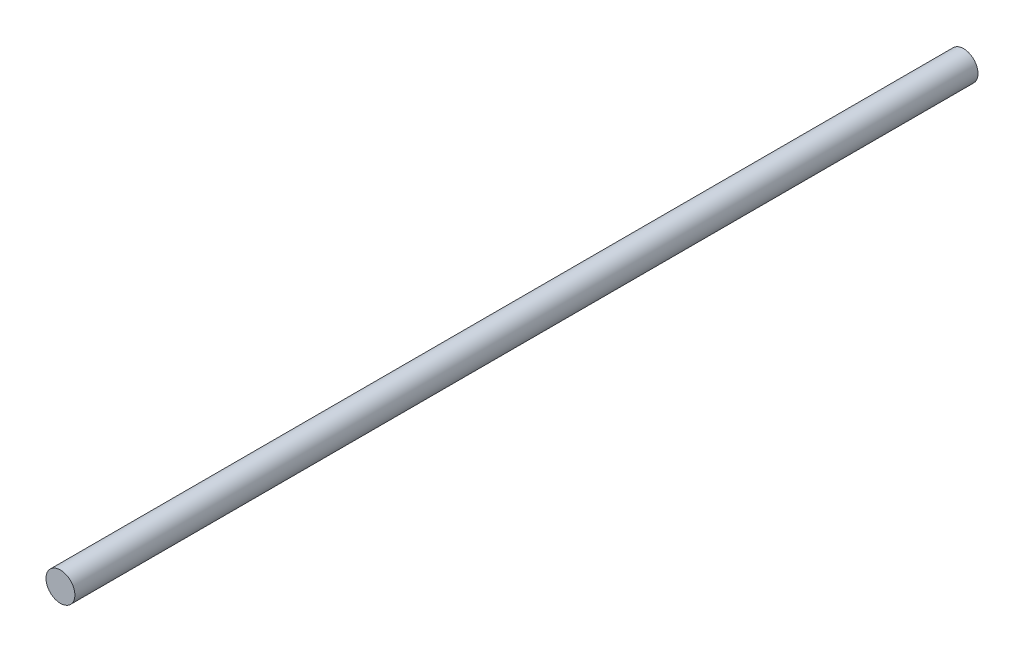
from build123d import *

# Parameters (mm, degrees)
SKETCH_1_R      = 4
EXTRUDE_1_DEPTH = 250


with BuildPart() as part:
    # Эскиз1 → Бобышка-Вытянуть1 (new body)
    with BuildSketch(Plane.XY):
        Circle(SKETCH_1_R)
    extrude(amount=EXTRUDE_1_DEPTH)


solid = part.part
